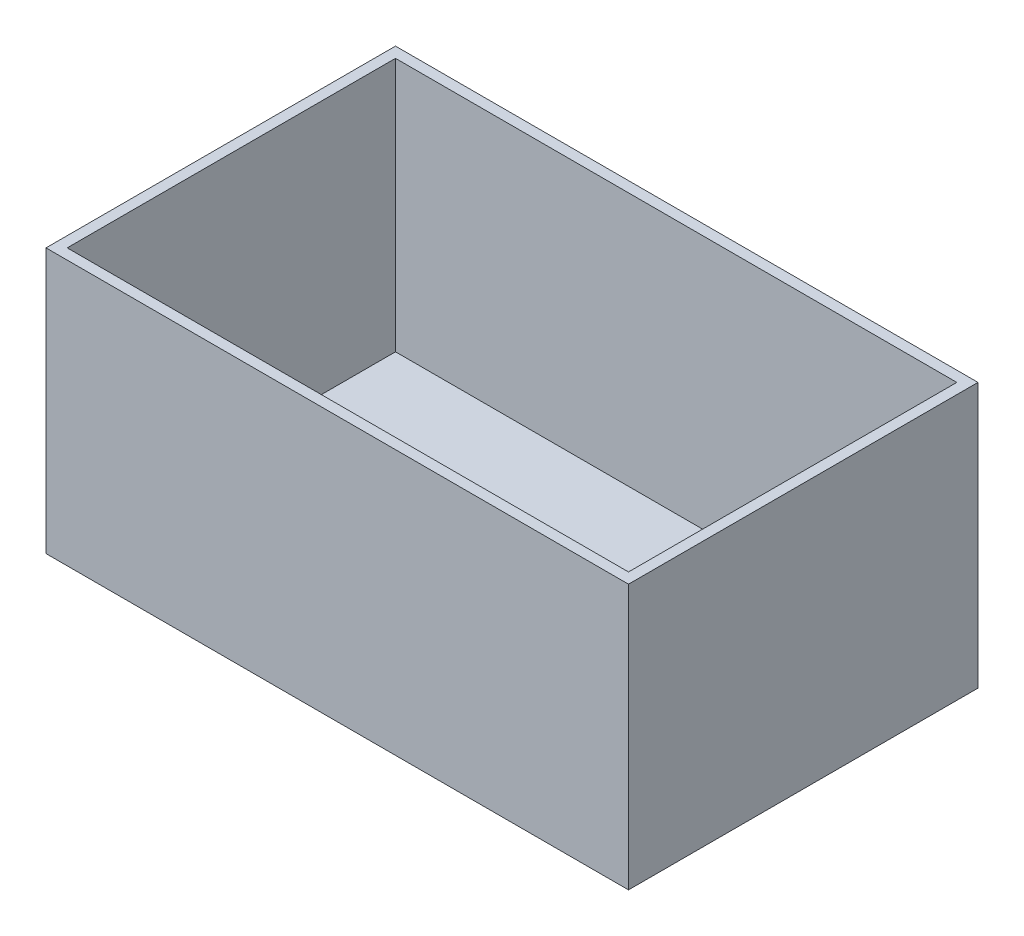
from build123d import *

# Parameters (mm, degrees)
SKETCH1_W           = 698.5
SKETCH1_H           = 419.1
BOSS_EXTRUDE1_DEPTH = 12.7
SKETCH1_3_W         = 698.5
SKETCH1_3_H         = 419.1
SKETCH1_3_W_2       = 673.1
SKETCH1_3_H_2       = 393.7
BOSS_EXTRUDE2_DEPTH = 304.8


with BuildPart() as part:
    # Sketch1 → Boss-Extrude1 (new body)
    with BuildSketch(Plane(origin=(0, 0, 0), x_dir=(1, 0, 0), z_dir=(0, 1, 0))):
        Rectangle(SKETCH1_W, SKETCH1_H)
    extrude(amount=-BOSS_EXTRUDE1_DEPTH)

    # Sketch1<3> → Boss-Extrude2 (add)
    with BuildSketch(Plane(origin=(0, 0, 0), x_dir=(1, 0, 0), z_dir=(0, 1, 0))):
        Rectangle(SKETCH1_3_W, SKETCH1_3_H)
        Rectangle(SKETCH1_3_W_2, SKETCH1_3_H_2, mode=Mode.SUBTRACT)
    extrude(amount=BOSS_EXTRUDE2_DEPTH)


solid = part.part
